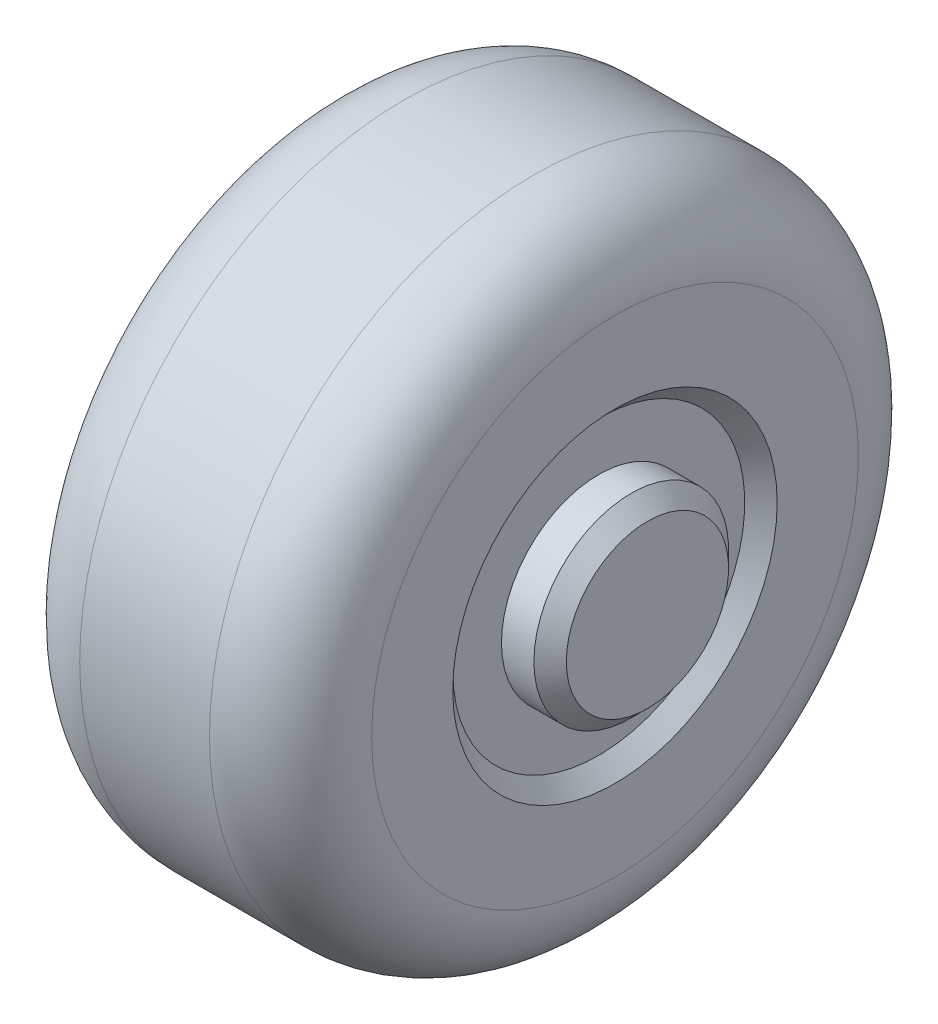
from build123d import *


with BuildPart() as part:
    # Sketch1 → Revolve1 (revolve)
    with BuildSketch(Plane.XY, mode=Mode.PRIVATE) as revolve1_sk:
        with BuildLine():
            Line((-11, 0), (-11, 5))
            Line((-11, 5), (-10, 6))
            Line((-10, 6), (-8, 6))
            Line((-8, 6), (-8, 9))
            Line((-8, 9), (-9, 10))
            Line((-9, 10), (-9, 15))
            ThreePointArc((-9, 15), (-7.535533906, 18.535533906), (-4, 20))
            Line((-4, 20), (4, 20))
            ThreePointArc((4, 20), (7.535533906, 18.535533906), (9, 15))
            Line((9, 15), (9, 10))
            Line((9, 10), (8, 9))
            Line((8, 9), (8, 6))
            Line((8, 6), (10, 6))
            Line((10, 6), (11, 5))
            Line((11, 5), (11, 0))
            Line((11, 0), (-11, 0))
        make_face()
    revolve(revolve1_sk.sketch.rotate(Axis((11, 0, 0), (-1, 0, 0)), 270), axis=Axis((11, 0, 0), (-1, 0, 0)))


solid = part.part
